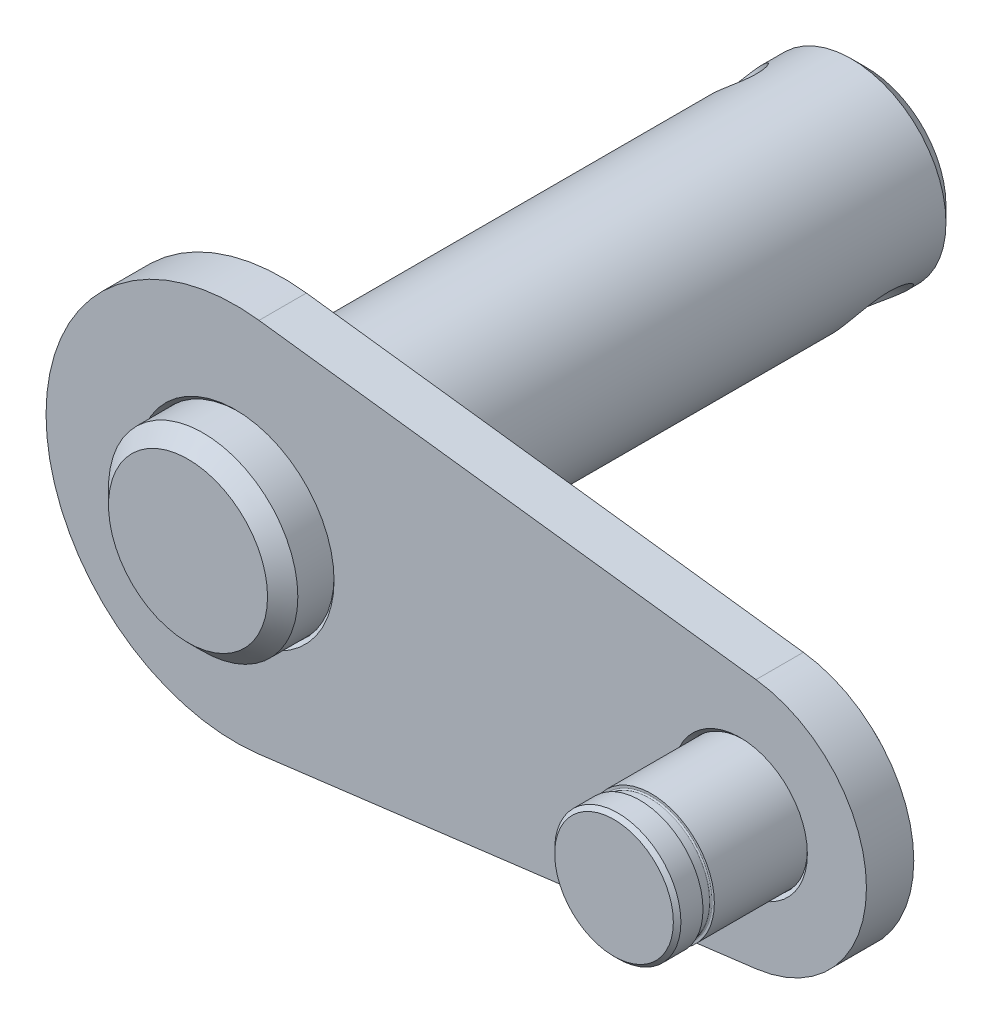
from build123d import *

# Parameters (mm, degrees)
BOSS_EXTRUDE1_DEPTH      = 2.38125
BOSS_EXTRUDE2_DEPTH      = 4.7625
BOSS_EXTRUDE2_DEPTH_BACK = 63.5
SKETCH2_R                = 9.525
BOSS_EXTRUDE3_DEPTH      = 12.7
BOSS_EXTRUDE3_DEPTH_BACK = 9.525
SKETCH3_R                = 6.35
SKETCH4_R                = 6.3754
SKETCH4_R_2              = 9.5504
CUT_EXTRUDE1_DEPTH       = 92.800885072
CHAMFER1_SIZE            = 1.524
CHAMFER2_SIZE            = 0.381
CHAMFER3_SIZE            = 0.381


with BuildPart() as part:
    # Sketch1 → Boss-Extrude1 (new, symmetric)
    with BuildSketch(Plane.XY):
        with BuildLine():
            ThreePointArc((2.38125, 18.900585928), (-19.05, 0), (2.38125, -18.900585928))
            Line((2.38125, -18.900585928), (52.3875, -12.600390619))
            ThreePointArc((52.3875, -12.600390619), (63.5, 0), (52.3875, 12.600390619))
            Line((52.3875, 12.600390619), (2.38125, 18.900585928))
        make_face()
    extrude(amount=BOSS_EXTRUDE1_DEPTH, both=True)

    # Sketch4 → Cut-Extrude1 (cut, through all)
    with BuildSketch(Plane.XY.offset(2.38125)):
        with Locations((50.8, 0)):
            Circle(SKETCH4_R)
        Circle(SKETCH4_R_2)
    extrude(amount=-CUT_EXTRUDE1_DEPTH, mode=Mode.SUBTRACT)

    # Chamfer3
    chamfer3_edges = [part.edges().sort_by_distance(p)[0] for p in [
        (44.4246, 0, -2.38125),
        (44.4246, 0, 2.38125),
        (-9.5504, 0, -2.38125),
        (-9.5504, 0, 2.38125),
    ]]
    chamfer(chamfer3_edges, length=CHAMFER3_SIZE)


with BuildPart() as body_2:
    # Sketch2 → Boss-Extrude2 (new, two sides: drawn at the far end of the back side and taken through both)
    with BuildSketch(Plane.XY.offset(2.38125).offset(-BOSS_EXTRUDE2_DEPTH_BACK)):
        Circle(SKETCH2_R)
    extrude(amount=BOSS_EXTRUDE2_DEPTH + BOSS_EXTRUDE2_DEPTH_BACK)

    # Chamfer1
    chamfer1_edges = [body_2.edges().sort_by_distance(p)[0] for p in [
        (-9.525, 0, -61.11875),
        (-9.525, 0, 7.14375),
    ]]
    chamfer(chamfer1_edges, length=CHAMFER1_SIZE)

    # Sketch7 → 1/4-20 Tapped Hole1 (revolve, cut)
    with BuildSketch(Plane(origin=(6.735192091, -6.735192091, -54.76875), x_dir=(0.7071067811865488, 0.7071067811865464, 0), z_dir=(0, 0, 1))):
        Polygon((0, 0), (0, 36.465768363), (3.81, 36.465768363), (2.5527, 35.208468363), (2.5527, 1.2573), (3.81, 0), align=None)
    revolve(axis=Axis((11.225320151, -11.225320151, -54.76875), (-0.7071067811865464, 0.7071067811865487, 0)), mode=Mode.SUBTRACT)


with BuildPart() as body_3:
    # Sketch3 → Boss-Extrude3 (new, two sides: drawn at the far end of the back side and taken through both)
    with BuildSketch(Plane.XY.offset(2.38125).offset(-BOSS_EXTRUDE3_DEPTH_BACK)):
        with Locations((50.8, 0)):
            Circle(SKETCH3_R)
    extrude(amount=BOSS_EXTRUDE3_DEPTH + BOSS_EXTRUDE3_DEPTH_BACK)

    # Chamfer2
    chamfer2_edges = [body_3.edges().sort_by_distance(p)[0] for p in [
        (44.45, 0, -7.14375),
        (44.45, 0, 15.08125),
    ]]
    chamfer(chamfer2_edges, length=CHAMFER2_SIZE)

    # Groove Sketch → Retaining Ring Groove (revolve, cut)
    with BuildSketch(Plane(origin=(12.915629716, 1.118285362, -17.503040002), x_dir=(0.034992182664449985, -0.0010329126589647126, 0.9993870522694481), z_dir=(-0.029505531457742346, -0.9995646170275317, 0)), mode=Mode.PRIVATE) as retaining_ring_groove_sk:
        with BuildLine():
            Line((30.361220287, -42.985751577), (30.369222984, -43.214211457))
            Line((30.369222984, -43.214211457), (31.511522385, -43.174197971))
            Line((31.511522385, -43.174197971), (31.503519688, -42.945738091))
            ThreePointArc((31.503519688, -42.945738091), (31.463201293, -42.85729276), (31.372151589, -42.823261878))
            Line((31.372151589, -42.823261878), (30.4836965, -42.854383478))
            ThreePointArc((30.4836965, -42.854383478), (30.39525117, -42.894701873), (30.361220287, -42.985751577))
        make_face()
    revolve(retaining_ring_groove_sk.sketch.rotate(Axis((50.8, 0, -19.256242745), (0, 0, 1)), 271.690787812), axis=Axis((50.8, 0, -19.256242745), (0, 0, 1)), mode=Mode.SUBTRACT)


solid = Compound([part.part, body_2.part, body_3.part])
